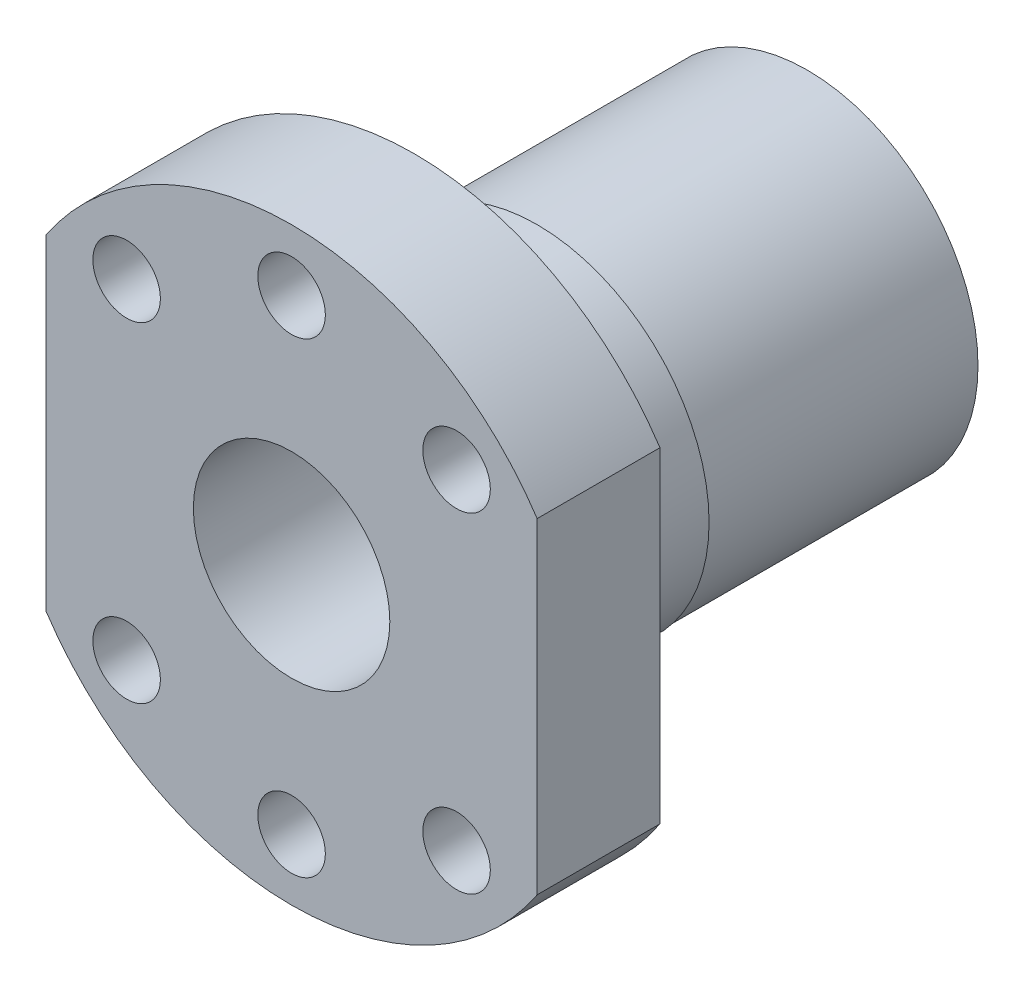
from build123d import *

# Parameters (mm, degrees)
SKETCH_1_R          = 24
EXTRUDE_1_DEPTH     = 10
SKETCH_2_R          = 14
EXTRUDE_2_DEPTH     = 10
SKETCH_3_R          = 13.9
EXTRUDE_3_DEPTH     = 22
CUT_EXTRUDE_START   = -22
CUT_EXTRUDE_1_DEPTH = 22
SKETCH_5_R          = 2.75
CUT_EXTRUDE_2_DEPTH = 22
SKETCH_6_R          = 8
CUT_EXTRUDE_3_DEPTH = 53.345009313


with BuildPart() as part:
    # 스케치1 → 보스-돌출1 (new body)
    with BuildSketch(Plane.XY):
        Circle(SKETCH_1_R)
    extrude(amount=EXTRUDE_1_DEPTH)

    # 스케치2 → 보스-돌출2 (add)
    with BuildSketch(Plane(origin=(0, 0, 0), x_dir=(-1, 0, 0), z_dir=(0, 0, -1))):
        Circle(SKETCH_2_R)
    extrude(amount=EXTRUDE_2_DEPTH)

    # 스케치3 → 보스-돌출3 (add)
    with BuildSketch(Plane(origin=(0, 0, -10), x_dir=(-1, 0, 0), z_dir=(0, 0, -1))):
        Circle(SKETCH_3_R)
    extrude(amount=EXTRUDE_3_DEPTH)

    # 스케치4 → 컷-돌출1 (cut)
    with BuildSketch(Plane.XY.offset(10).offset(CUT_EXTRUDE_START)):
        with BuildLine():
            ThreePointArc((24, 0), (22.978250586, 6.92820323), (20, 13.266499161))
            Line((20, 13.266499161), (20, -13.266499161))
            ThreePointArc((20, -13.266499161), (22.978250586, -6.92820323), (24, 0))
        make_face()
        with BuildLine():
            Line((-20, -13.266499161), (-20, 13.266499161))
            ThreePointArc((-20, 13.266499161), (-24, 0), (-20, -13.266499161))
        make_face()
    extrude(amount=CUT_EXTRUDE_1_DEPTH, mode=Mode.SUBTRACT)

    # 스케치5 → 컷-돌출2 (cut)
    with BuildSketch(Plane.XY.offset(10)):
        with Locations((0, 19)):
            Circle(SKETCH_5_R)
        with Locations((-13.435028843, 13.435028843)):
            Circle(SKETCH_5_R)
        with Locations((13.435028843, 13.435028843)):
            Circle(SKETCH_5_R)
        with Locations((13.435028843, -13.435028843)):
            Circle(SKETCH_5_R)
        with Locations((0, -19)):
            Circle(SKETCH_5_R)
        with Locations((-13.435028843, -13.435028843)):
            Circle(SKETCH_5_R)
    extrude(amount=-CUT_EXTRUDE_2_DEPTH, mode=Mode.SUBTRACT)

    # 스케치6 → 컷-돌출3 (cut, through all)
    with BuildSketch(Plane.XY.offset(10)):
        Circle(SKETCH_6_R)
    extrude(amount=-CUT_EXTRUDE_3_DEPTH, mode=Mode.SUBTRACT)


solid = part.part
